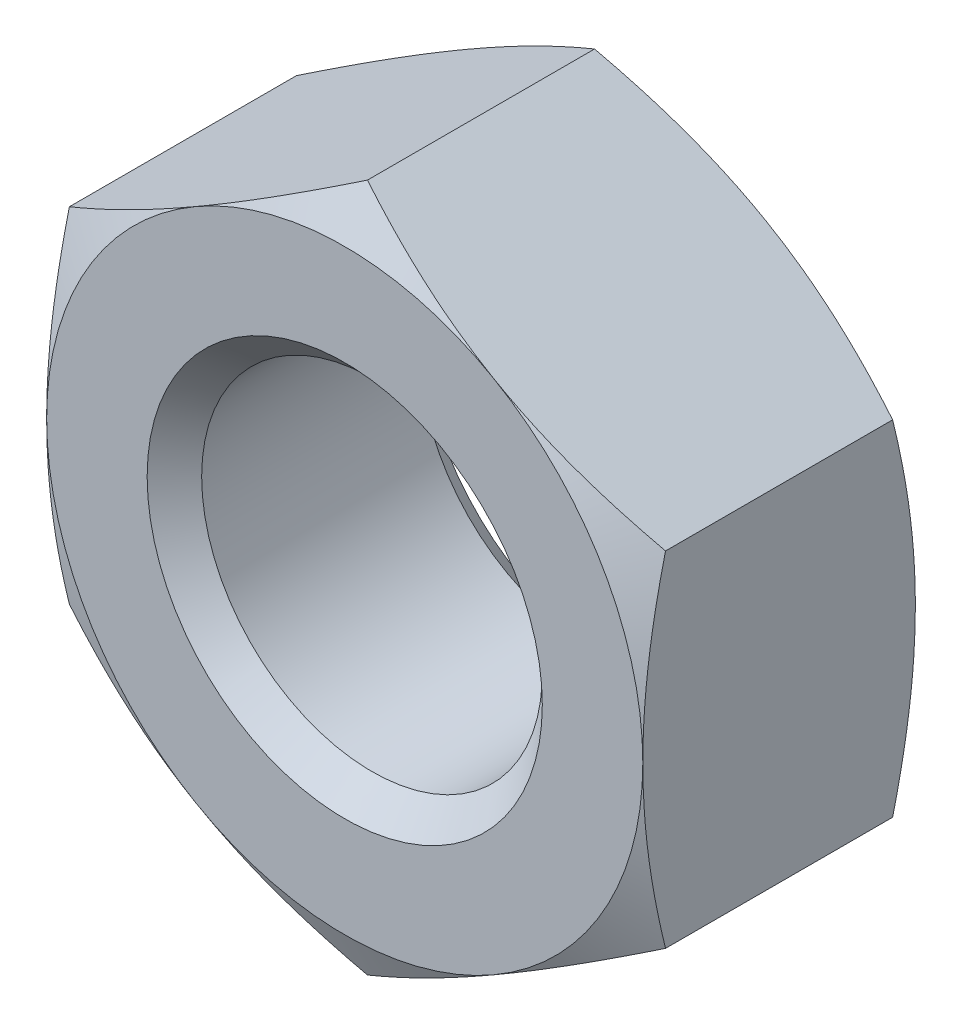
from build123d import *

# Parameters (mm, degrees)
SKETCH1_R           = 2
BOSS_EXTRUDE1_DEPTH = 3.2


with BuildPart() as part:
    # Sketch1 → Boss-Extrude1 (new body)
    with BuildSketch(Plane.XY):
        Polygon((0, -4.041451884), (3.5, -2.020725942), (3.5, 2.020725942), (0, 4.041451884), (-3.5, 2.020725942), (-3.5, -2.020725942), align=None)
        Circle(SKETCH1_R, mode=Mode.SUBTRACT)
    extrude(amount=BOSS_EXTRUDE1_DEPTH)

    # Sketch2 → Cut-Revolve1 (revolve, cut)
    with BuildSketch(Plane(origin=(0, 0, 0), x_dir=(0, 0, -1), z_dir=(1, 0, 0)), mode=Mode.PRIVATE) as cut_revolve1_sk:
        Polygon((-3.2, 4.041451884), (-3.2, 3.5), (-2.933333333, 4.041451884), align=None)
        Polygon((-0.266666667, 4.041451884), (0, 4.041451884), (0, 3.5), align=None)
        Polygon((-3.2, 2), (-2.88, 2), (-3.2, 2.32), align=None)
        Polygon((0, 2), (-0.32, 2), (0, 2.32), align=None)
    revolve(cut_revolve1_sk.sketch.rotate(Axis((0, 0, 0), (0, 0, 1)), 90), axis=Axis((0, 0, 0), (0, 0, 1)), mode=Mode.SUBTRACT)


solid = part.part
